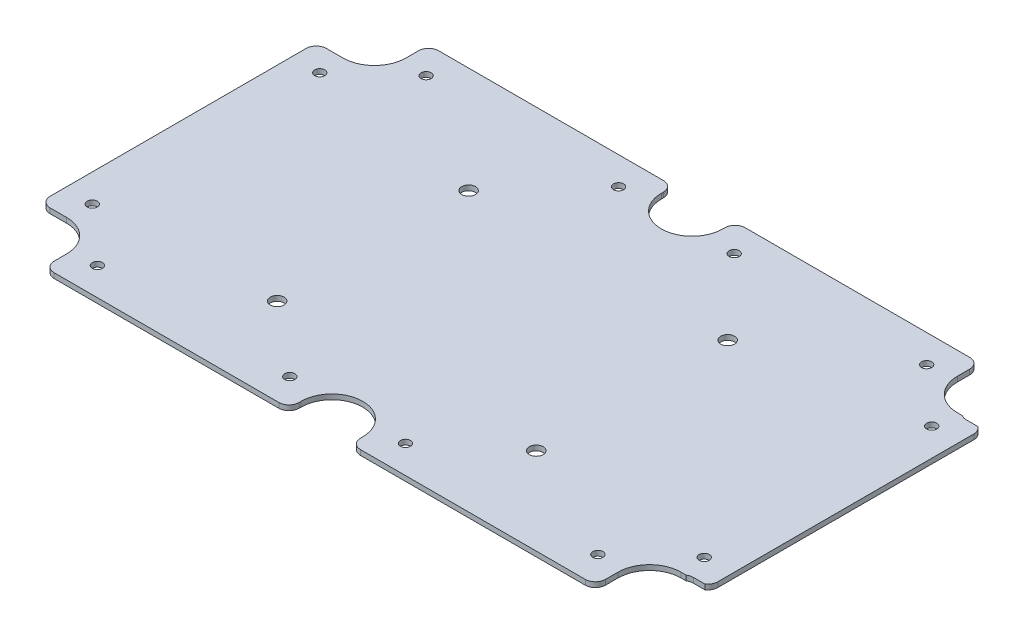
from build123d import *

# Parameters (mm, degrees)
SKETCH1_R           = 1.5875
BOSS_EXTRUDE1_DEPTH = 1.5875
CUT_EXTRUDE1_DEPTH  = 10


with BuildPart() as part:
    # Sketch1 → Boss-Extrude1 (new body)
    with BuildSketch(Plane.XZ.offset(-9.652)):
        with BuildLine():
            Line((-9.649529152, -57.088970848), (-9.649529152, -56.4515))
            ThreePointArc((-9.649529152, -56.4515), (0, -46.801970848), (9.649529152, -56.4515))
            Line((9.649529152, -56.4515), (9.649529152, -57.088970848))
            ThreePointArc((9.649529152, -57.088970848), (10.579465122, -59.334034878), (12.824529152, -60.263970848))
            Line((12.824529152, -60.263970848), (83.228304068, -60.263970848))
            ThreePointArc((83.228304068, -60.263970848), (85.473368098, -59.334034878), (86.403304068, -57.088970848))
            Line((86.403304068, -57.088970848), (86.403304068, -53.197827078))
            ThreePointArc((86.403304068, -53.197827078), (89.303980599, -46.194974456), (96.306833221, -43.294297925))
            Line((96.306833221, -43.294297925), (97.90475189, -43.294297925))
            ThreePointArc((97.90475189, -43.294297925), (98.735652203, -42.90897515), (99.641972868, -42.776869801))
            Line((99.641972868, -42.776869801), (103.212691826, -42.776869801))
            ThreePointArc((103.212691826, -42.776869801), (104.267987777, -41.630083879), (104.650470848, -40.119297925))
            Line((104.650470848, -40.119297925), (104.650470848, 40.119297925))
            ThreePointArc((104.650470848, 40.119297925), (104.267987777, 41.630083879), (103.212691826, 42.776869801))
            Line((103.212691826, 42.776869801), (99.641972868, 42.776869801))
            ThreePointArc((99.641972868, 42.776869801), (98.735652203, 42.90897515), (97.90475189, 43.294297925))
            Line((97.90475189, 43.294297925), (96.306833221, 43.294297925))
            ThreePointArc((96.306833221, 43.294297925), (89.303980599, 46.194974456), (86.403304068, 53.197827078))
            Line((86.403304068, 53.197827078), (86.403304068, 57.088970848))
            ThreePointArc((86.403304068, 57.088970848), (85.473368098, 59.334034878), (83.228304068, 60.263970848))
            Line((83.228304068, 60.263970848), (12.824529152, 60.263970848))
            ThreePointArc((12.824529152, 60.263970848), (10.579465122, 59.334034878), (9.649529152, 57.088970848))
            Line((9.649529152, 57.088970848), (9.649529152, 56.4515))
            ThreePointArc((9.649529152, 56.4515), (0, 46.801970848), (-9.649529152, 56.4515))
            Line((-9.649529152, 56.4515), (-9.649529152, 57.088970848))
            ThreePointArc((-9.649529152, 57.088970848), (-10.579465122, 59.334034878), (-12.824529152, 60.263970848))
            Line((-12.824529152, 60.263970848), (-83.228304068, 60.263970848))
            ThreePointArc((-83.228304068, 60.263970848), (-85.473368098, 59.334034878), (-86.403304068, 57.088970848))
            Line((-86.403304068, 57.088970848), (-86.403304068, 53.197827078))
            ThreePointArc((-86.403304068, 53.197827078), (-89.303980599, 46.194974456), (-96.306833221, 43.294297925))
            Line((-96.306833221, 43.294297925), (-101.475470848, 43.294297925))
            ThreePointArc((-101.475470848, 43.294297925), (-103.720534878, 42.364361955), (-104.650470848, 40.119297925))
            Line((-104.650470848, 40.119297925), (-104.650470848, -40.119297925))
            ThreePointArc((-104.650470848, -40.119297925), (-103.720534878, -42.364361955), (-101.475470848, -43.294297925))
            Line((-101.475470848, -43.294297925), (-96.306833221, -43.294297925))
            ThreePointArc((-96.306833221, -43.294297925), (-89.303980599, -46.194974456), (-86.403304068, -53.197827078))
            Line((-86.403304068, -53.197827078), (-86.403304068, -57.088970848))
            ThreePointArc((-86.403304068, -57.088970848), (-85.473368098, -59.334034878), (-83.228304068, -60.263970848))
            Line((-83.228304068, -60.263970848), (-12.824529152, -60.263970848))
            ThreePointArc((-12.824529152, -60.263970848), (-10.579465122, -59.334034878), (-9.649529152, -57.088970848))
        make_face()
        with Locations(Location((18.12925, 51.53025, 0), (0, 0, 90))):
            Circle(SKETCH1_R, mode=Mode.SUBTRACT)
        with Locations(Location((18.12925, -51.53025, 0), (0, 0, 90))):
            Circle(SKETCH1_R, mode=Mode.SUBTRACT)
        with Locations(Location((95.91675, -35.65525, 0), (0, 0, 90))):
            Circle(SKETCH1_R, mode=Mode.SUBTRACT)
        with Locations(Location((78.45425, 51.53025, 0), (0, 0, 90))):
            Circle(SKETCH1_R, mode=Mode.SUBTRACT)
        with Locations(Location((-95.91675, 35.65525, 0), (0, 0, 90))):
            Circle(SKETCH1_R, mode=Mode.SUBTRACT)
        with Locations(Location((-78.45425, -51.53025, 0), (0, 0, 90))):
            Circle(SKETCH1_R, mode=Mode.SUBTRACT)
        with Locations(Location((-18.12925, -51.53025, 0), (0, 0, 90))):
            Circle(SKETCH1_R, mode=Mode.SUBTRACT)
        with Locations(Location((-95.91675, -35.65525, 0), (0, 0, 90))):
            Circle(SKETCH1_R, mode=Mode.SUBTRACT)
        with Locations(Location((-78.45425, 51.53025, 0), (0, 0, 90))):
            Circle(SKETCH1_R, mode=Mode.SUBTRACT)
        with Locations(Location((95.91675, 35.65525, 0), (0, 0, 90))):
            Circle(SKETCH1_R, mode=Mode.SUBTRACT)
        with Locations(Location((78.45425, -51.53025, 0), (0, 0, 90))):
            Circle(SKETCH1_R, mode=Mode.SUBTRACT)
        with Locations(Location((-18.12925, 51.53025, 0), (0, 0, 90))):
            Circle(SKETCH1_R, mode=Mode.SUBTRACT)
    extrude(amount=-BOSS_EXTRUDE1_DEPTH)

    # Sketch2 → Cut-Extrude1 (cut)
    with BuildSketch(Plane(origin=(0, 11.2395, 0), x_dir=(1, 0, 0), z_dir=(0, 1, 0))):
        with BuildLine():
            ThreePointArc((-38.445, 27), (-42.132350647, 28.527350647), (-40.605, 24.84))
            Line((-40.605, 24.84), (-40.605, 27))
            Line((-40.605, 27), (-38.445, 27))
        make_face()
        with BuildLine():
            Line((-40.605, 27), (-40.605, 24.84))
            ThreePointArc((-40.605, 24.84), (-39.077649353, 25.472649353), (-38.445, 27))
            Line((-38.445, 27), (-40.605, 27))
        make_face()
        with BuildLine():
            Line((-38.445, -33), (-40.605, -33))
            Line((-40.605, -33), (-40.605, -30.84))
            ThreePointArc((-40.605, -30.84), (-42.132350647, -34.527350647), (-38.445, -33))
        make_face()
        with BuildLine():
            Line((-40.605, -30.84), (-40.605, -33))
            Line((-40.605, -33), (-38.445, -33))
            ThreePointArc((-38.445, -33), (-39.077649353, -31.472649353), (-40.605, -30.84))
        make_face()
        with BuildLine():
            ThreePointArc((40.605, -30.84), (39.077649353, -31.472649353), (38.445, -33))
            Line((38.445, -33), (40.605, -33))
            Line((40.605, -33), (40.605, -30.84))
        make_face()
        with BuildLine():
            Line((40.605, -33), (38.445, -33))
            ThreePointArc((38.445, -33), (40.605, -35.16), (42.765, -33))
            ThreePointArc((42.765, -33), (42.132350647, -31.472649353), (40.605, -30.84))
            Line((40.605, -30.84), (40.605, -33))
        make_face()
        with BuildLine():
            ThreePointArc((42.765, 27), (40.605, 29.16), (38.445, 27))
            Line((38.445, 27), (40.605, 27))
            Line((40.605, 27), (40.605, 24.84))
            ThreePointArc((40.605, 24.84), (42.132350647, 25.472649353), (42.765, 27))
        make_face()
        with BuildLine():
            Line((40.605, 27), (38.445, 27))
            ThreePointArc((38.445, 27), (39.077649353, 25.472649353), (40.605, 24.84))
            Line((40.605, 24.84), (40.605, 27))
        make_face()
    extrude(amount=-CUT_EXTRUDE1_DEPTH, mode=Mode.SUBTRACT)


solid = part.part
